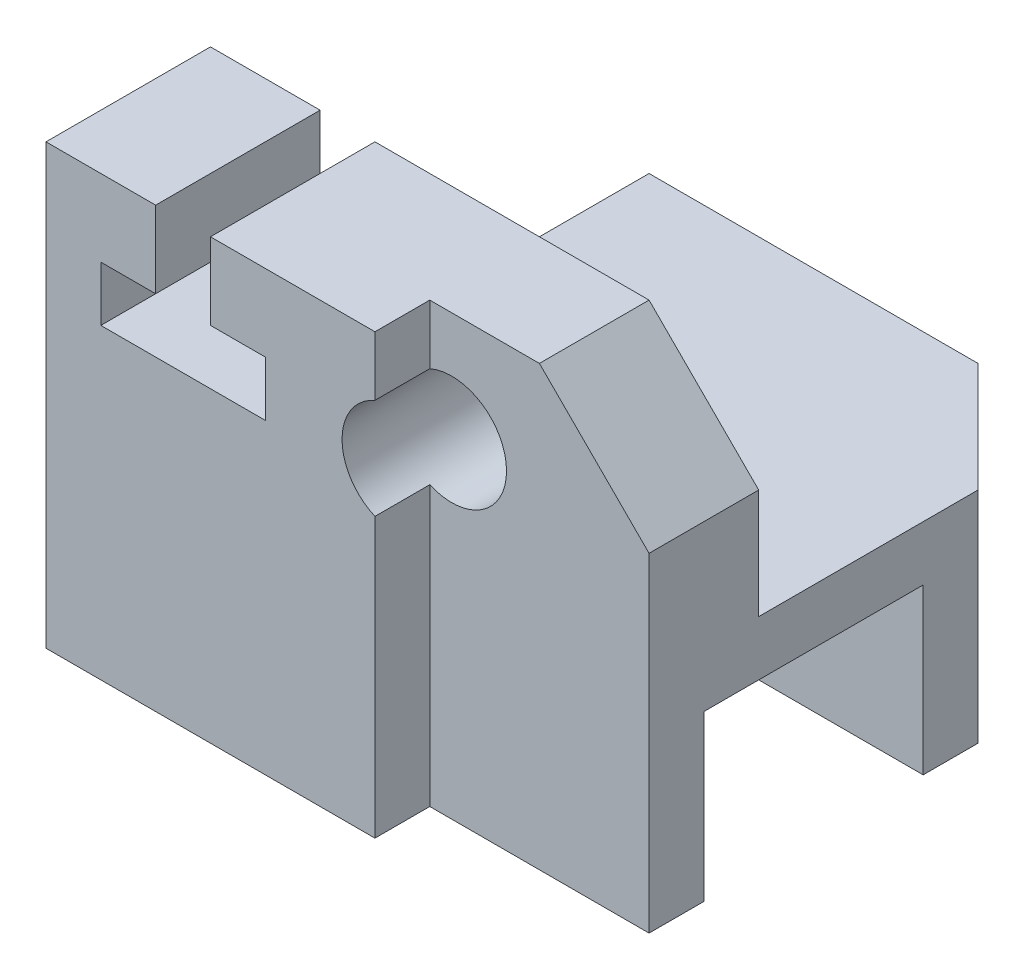
from build123d import *

# Parameters (mm, degrees)
ESQUISSE3_W             = 50
ESQUISSE3_H             = 40
BOSS_EXTRU_1_DEPTH      = 22.5
ESQUISSE7_W             = 30
ESQUISSE7_H             = 20
ENL_V_MAT_EXTRU_1_DEPTH = 78.551730665
ESQUISSE8_W             = 5
ESQUISSE8_H             = 40
ENL_V_MAT_EXTRU_2_DEPTH = 20
ESQUISSE9_W             = 15
ESQUISSE9_H             = 10
ENL_V_MAT_EXTRU_3_DEPTH = 10
CHANFREIN2_SIZE         = 10
CHANFREIN3_SIZE         = 10
ENL_V_MAT_EXTRU_4_DEPTH = 109.911404208
ESQUISSE11_W            = 20
ESQUISSE11_H            = 15
ENL_V_MAT_EXTRU_5_DEPTH = 25
ESQUISSE12_W            = 10
ESQUISSE12_H            = 15
ENL_V_MAT_EXTRU_6_DEPTH = 25
ESQUISSE14_R            = 3
ENL_V_MAT_EXTRU_7_DEPTH = 95.127164185
ESQUISSE15_R            = 5
ENL_V_MAT_EXTRU_8_DEPTH = 109.911404208


with BuildPart() as part:
    # Esquisse3 → Boss.-Extru.1 (new, symmetric)
    with BuildSketch(Plane.XY):
        with Locations((-64.183367493, -34.845427604)):
            Rectangle(ESQUISSE3_W, ESQUISSE3_H)
    extrude(amount=BOSS_EXTRU_1_DEPTH, both=True)

    # Esquisse7 → Enlèv. mat.-Extru.1 (cut, through all)
    with BuildSketch(Plane(origin=(-39.183367493, 0, 0), x_dir=(0, 0, -1), z_dir=(1, 0, 0))):
        with Locations((7.5, -24.845427604)):
            Rectangle(ESQUISSE7_W, ESQUISSE7_H)
    extrude(amount=-ENL_V_MAT_EXTRU_1_DEPTH, mode=Mode.SUBTRACT)

    # Esquisse8 → Enlèv. mat.-Extru.2 (cut)
    with BuildSketch(Plane(origin=(-39.183367493, 0, 0), x_dir=(0, 0, -1), z_dir=(1, 0, 0))):
        with Locations((-20, -34.845427604)):
            Rectangle(ESQUISSE8_W, ESQUISSE8_H)
    extrude(amount=-ENL_V_MAT_EXTRU_2_DEPTH, mode=Mode.SUBTRACT)

    # Esquisse9 → Enlèv. mat.-Extru.3 (cut)
    with BuildSketch(Plane.ZY.offset(89.183367493)):
        with Locations((-15, -39.845427604)):
            Rectangle(ESQUISSE9_W, ESQUISSE9_H)
    extrude(amount=-ENL_V_MAT_EXTRU_3_DEPTH, mode=Mode.SUBTRACT)

    # Chanfrein2
    chanfrein2_edges = [part.edges().sort_by_distance(p)[0] for p in [
        (-39.183367493, -14.845427604, 12.5),
    ]]
    chamfer(chanfrein2_edges, length=CHANFREIN2_SIZE)

    # Chanfrein3
    chanfrein3_edges = [part.edges().sort_by_distance(p)[0] for p in [
        (-39.183367493, -44.845427604, -22.5),
    ]]
    chamfer(chanfrein3_edges, length=CHANFREIN3_SIZE)

    # Esquisse10 → Enlèv. mat.-Extru.4 (cut, through all)
    with BuildSketch(Plane(origin=(0, 0, 7.5), x_dir=(-1, 0, 0), z_dir=(0, 0, -1))):
        Polygon((74.183367493, -14.845427604), (79.183367493, -14.845427604), (79.183367493, -21.845427604), (84.183367493, -21.845427604), (84.183367493, -26.845427604), (69.183367493, -26.845427604), (69.183367493, -21.845427604), (74.183367493, -21.845427604), align=None)
    extrude(amount=-ENL_V_MAT_EXTRU_4_DEPTH, mode=Mode.SUBTRACT)

    # Esquisse11 → Enlèv. mat.-Extru.5 (cut)
    with BuildSketch(Plane(origin=(-39.183367493, 0, 0), x_dir=(0, 0, -1), z_dir=(1, 0, 0))):
        with Locations((-2.5, -47.345427604)):
            Rectangle(ESQUISSE11_W, ESQUISSE11_H)
    extrude(amount=-ENL_V_MAT_EXTRU_5_DEPTH, mode=Mode.SUBTRACT)

    # Esquisse12 → Enlèv. mat.-Extru.6 (cut)
    with BuildSketch(Plane(origin=(0, 0, -22.5), x_dir=(-1, 0, 0), z_dir=(0, 0, -1))):
        with Locations((59.183367493, -47.345427604)):
            Rectangle(ESQUISSE12_W, ESQUISSE12_H)
    extrude(amount=-ENL_V_MAT_EXTRU_6_DEPTH, mode=Mode.SUBTRACT)

    # Esquisse14 → Enlèv. mat.-Extru.7 (cut, through all)
    with BuildSketch(Plane(origin=(0, -34.845427604, 0), x_dir=(1, 0, 0), z_dir=(0, 1, 0))):
        with Locations(Location((-74.183367493, 3.5, 0), (0, 0, 270))):
            Circle(ESQUISSE14_R)
    extrude(amount=-ENL_V_MAT_EXTRU_7_DEPTH, mode=Mode.SUBTRACT)

    # Esquisse15 → Enlèv. mat.-Extru.8 (cut, through all)
    with BuildSketch(Plane(origin=(0, 0, 7.5), x_dir=(-1, 0, 0), z_dir=(0, 0, -1))):
        with Locations((57.183367493, -24.845427604)):
            Circle(ESQUISSE15_R)
    extrude(amount=-ENL_V_MAT_EXTRU_8_DEPTH, mode=Mode.SUBTRACT)


solid = part.part
